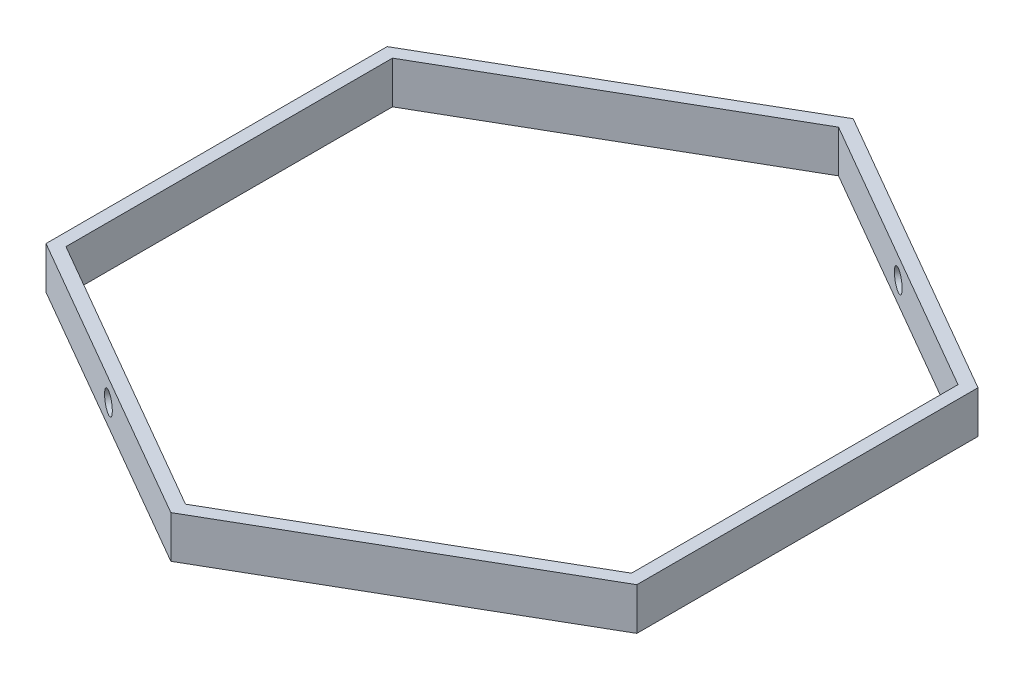
from build123d import *

# Parameters (mm, degrees)
RESSALTO_EXTRUS_O1_DEPTH = 4
ESBO_O2_R                = 1
CORTE_EXTRUS_O1_DEPTH    = 71.578561429


with BuildPart() as part:
    # Esboço1 → Ressalto-extrusão1 (new body)
    with BuildSketch(Plane(origin=(0, 0, 0), x_dir=(1, 0, 0), z_dir=(0, 1, 0))):
        Polygon((28, -16.165807537), (28, 16.165807537), (0, 32.331615075), (-28, 16.165807537), (-28, -16.165807537), (0, -32.331615075), align=None)
        Polygon((26.8, 15.472987214), (0, 30.945974429), (-26.8, 15.472987214), (-26.8, -15.472987214), (0, -30.945974429), (26.8, -15.472987214), align=None, mode=Mode.SUBTRACT)
    extrude(amount=RESSALTO_EXTRUS_O1_DEPTH)

    # Esboço2 → Corte-extrusão1 (cut, through all)
    with BuildSketch(Plane(origin=(-14, 0, 24.248711306), x_dir=(0.8660254037844387, 0, 0.49999999999999994), z_dir=(-0.4999999999999999, 0, 0.8660254037844386))):
        with Locations((0, 2)):
            Circle(ESBO_O2_R)
    extrude(amount=-CORTE_EXTRUS_O1_DEPTH, mode=Mode.SUBTRACT)


solid = part.part
